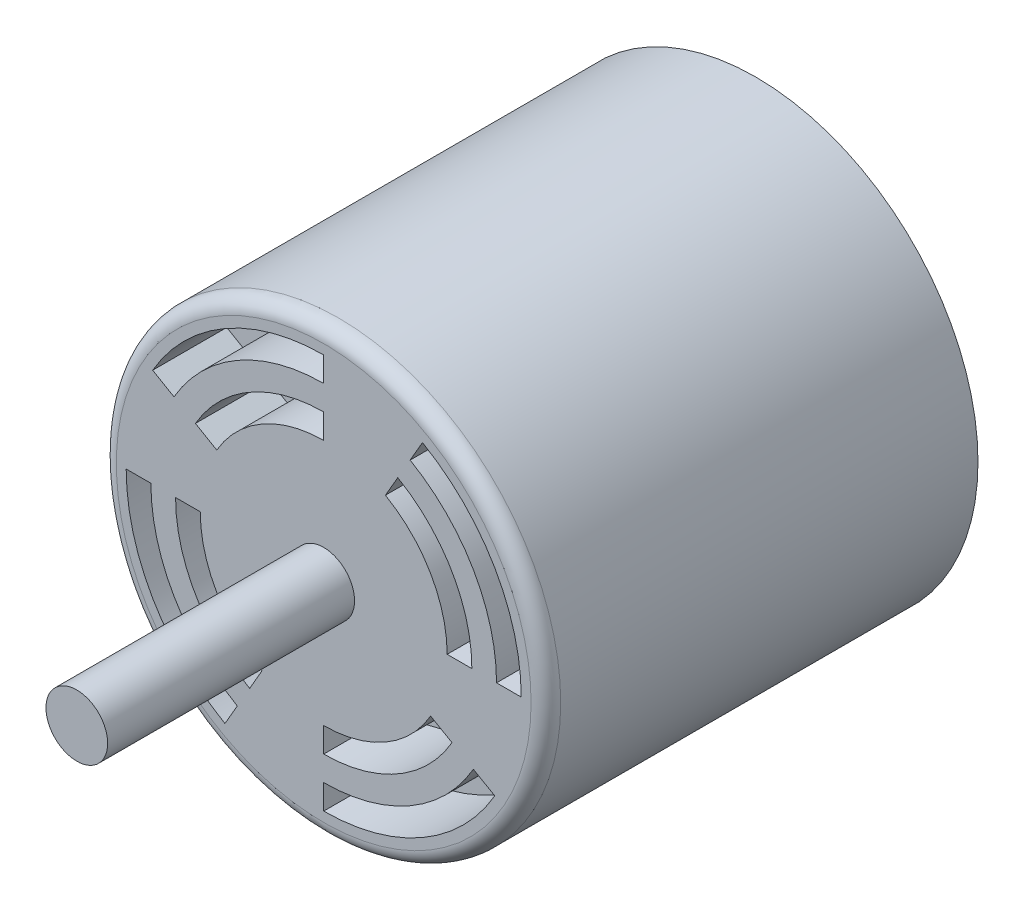
from build123d import *

# Parameters (mm, degrees)
SKETCH1_R           = 22.86
BOSS_EXTRUDE1_DEPTH = 44.45
SKETCH2_R           = 3.175
BOSS_EXTRUDE2_DEPTH = 25.4
CUT_EXTRUDE1_DEPTH  = 7.62
FILLET1_R           = 1.524


with BuildPart() as part:
    # Sketch1 → Boss-Extrude1 (new body)
    with BuildSketch(Plane.XY):
        Circle(SKETCH1_R)
    extrude(amount=BOSS_EXTRUDE1_DEPTH)

    # Sketch2 → Boss-Extrude2 (add)
    with BuildSketch(Plane.XY.offset(44.45)):
        Circle(SKETCH2_R)
    extrude(amount=BOSS_EXTRUDE2_DEPTH)

    # Sketch3 → Cut-Extrude1 (cut)
    with BuildSketch(Plane.XY.offset(44.45)):
        with BuildLine():
            Line((12.7, 0), (15.24, 0))
            ThreePointArc((15.24, 0), (13.198227154, 7.62), (7.62, 13.198227154))
            Line((7.62, 13.198227154), (6.35, 10.998522628))
            ThreePointArc((6.35, 10.998522628), (10.998522628, 6.35), (12.7, 0))
        make_face()
        with BuildLine():
            Line((8.89, 15.397931679), (10.16, 17.597636205))
            ThreePointArc((10.16, 17.597636205), (17.597636205, 10.16), (20.32, 0))
            Line((20.32, 0), (17.78, 0))
            ThreePointArc((17.78, 0), (15.397931679, 8.89), (8.89, 15.397931679))
        make_face()
        with BuildLine():
            Line((10.998522628, -6.35), (13.198227154, -7.62))
            ThreePointArc((13.198227154, -7.62), (7.62, -13.198227154), (0, -15.24))
            Line((0, -15.24), (0, -12.7))
            ThreePointArc((0, -12.7), (6.35, -10.998522628), (10.998522628, -6.35))
        make_face()
        with BuildLine():
            Line((0, -17.78), (0, -20.32))
            ThreePointArc((0, -20.32), (10.16, -17.597636205), (17.597636205, -10.16))
            Line((17.597636205, -10.16), (15.397931679, -8.89))
            ThreePointArc((15.397931679, -8.89), (8.89, -15.397931679), (0, -17.78))
        make_face()
        with BuildLine():
            Line((-6.35, -10.998522628), (-7.62, -13.198227154))
            ThreePointArc((-7.62, -13.198227154), (-13.198227154, -7.62), (-15.24, 0))
            Line((-15.24, 0), (-12.7, 0))
            ThreePointArc((-12.7, 0), (-10.998522628, -6.35), (-6.35, -10.998522628))
        make_face()
        with BuildLine():
            Line((-17.78, 0), (-20.32, 0))
            ThreePointArc((-20.32, 0), (-17.597636205, -10.16), (-10.16, -17.597636205))
            Line((-10.16, -17.597636205), (-8.89, -15.397931679))
            ThreePointArc((-8.89, -15.397931679), (-15.397931679, -8.89), (-17.78, 0))
        make_face()
        with BuildLine():
            Line((-10.998522628, 6.35), (-13.198227154, 7.62))
            ThreePointArc((-13.198227154, 7.62), (-7.62, 13.198227154), (0, 15.24))
            Line((0, 15.24), (0, 12.7))
            ThreePointArc((0, 12.7), (-6.35, 10.998522628), (-10.998522628, 6.35))
        make_face()
        with BuildLine():
            Line((0, 17.78), (0, 20.32))
            ThreePointArc((0, 20.32), (-10.16, 17.597636205), (-17.597636205, 10.16))
            Line((-17.597636205, 10.16), (-15.397931679, 8.89))
            ThreePointArc((-15.397931679, 8.89), (-8.89, 15.397931679), (0, 17.78))
        make_face()
    extrude(amount=-CUT_EXTRUDE1_DEPTH, mode=Mode.SUBTRACT)

    # Fillet1
    fillet1_edges = [part.edges().sort_by_distance(p)[0] for p in [
        (-22.86, 0, 44.45),
    ]]
    fillet(fillet1_edges, radius=FILLET1_R)


solid = part.part
